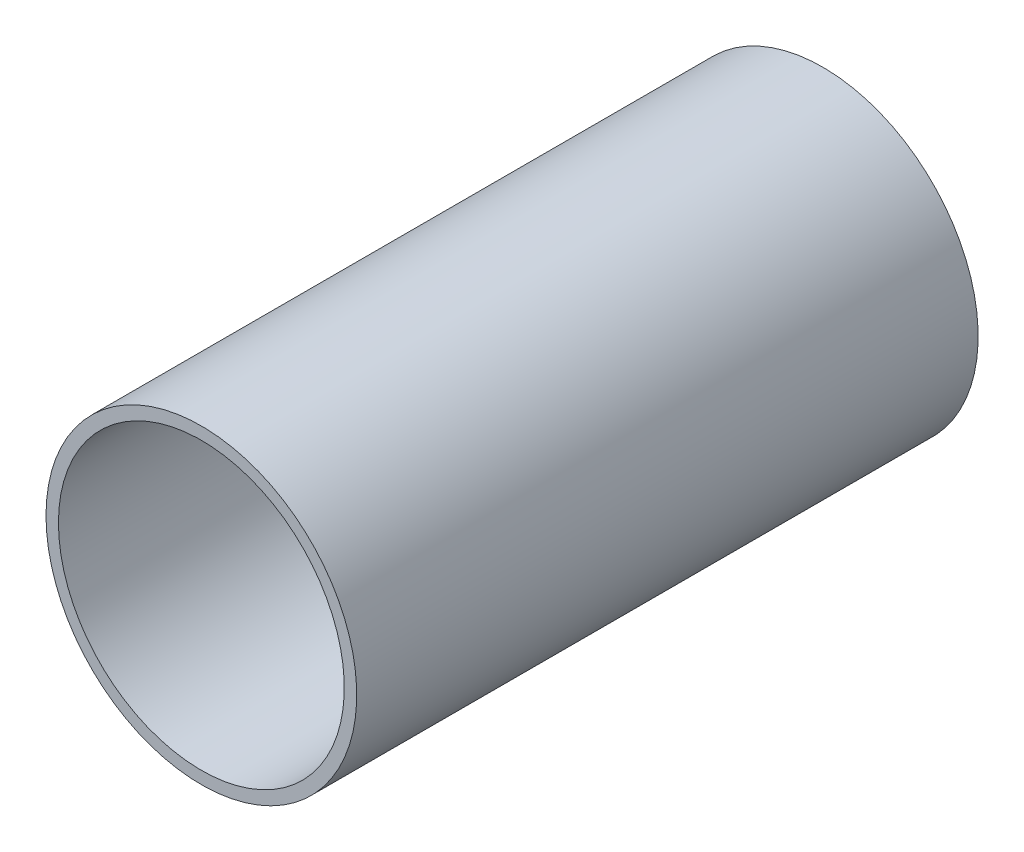
from build123d import *

# Parameters (mm, degrees)
SKETCH1_R           = 38.1
SKETCH1_R_2         = 35.052
BOSS_EXTRUDE1_DEPTH = 152.4


with BuildPart() as part:
    # Sketch1 → Boss-Extrude1 (new body)
    with BuildSketch(Plane.XY):
        with Locations(Location((0, 0, 0), (0, 0, 180))):
            Circle(SKETCH1_R)
        with Locations(Location((0, 0, 0), (0, 0, 180))):
            Circle(SKETCH1_R_2, mode=Mode.SUBTRACT)
    extrude(amount=BOSS_EXTRUDE1_DEPTH)


solid = part.part
